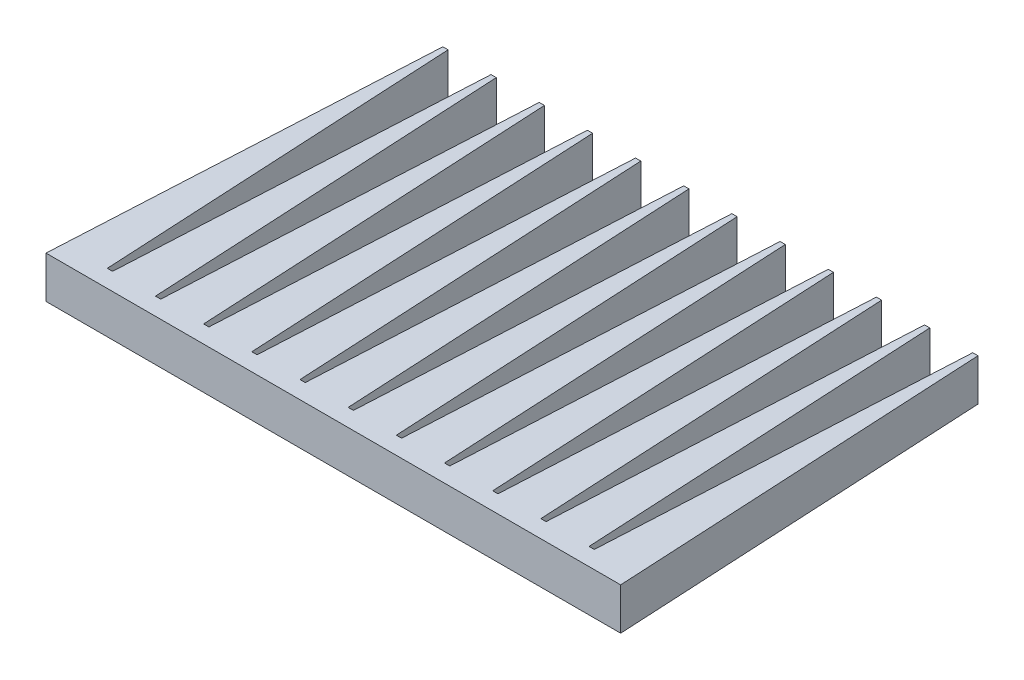
from build123d import *

# Parameters (mm, degrees)
BOSS_EXTRUDE1_DEPTH = 12


with BuildPart() as part:
    # Sketch1 → Boss-Extrude1 (new body)
    with BuildSketch(Plane(origin=(0, 0, 0), x_dir=(1, 0, 0), z_dir=(0, 1, 0))):
        Polygon((0.05286405, -1.233322687), (58.079634763, -1.233322687), (58.340079822, -1.233322687), (58.078040925, 3.766677313), (52.680039659, 106.766677313), (51.180039659, 106.766677313), (45.782038393, 3.766677313), (44.282038393, 3.766677313), (38.884037127, 106.766677313), (37.384037127, 106.766677313), (31.98603586, 3.766677313), (30.48603586, 3.766677313), (25.088034594, 106.766677313), (23.588034594, 106.766677313), (18.190033328, 3.766677313), (16.690033328, 3.766677313), (11.292032062, 106.766677313), (9.792032062, 106.766677313), (4.394030796, 3.766677313), (2.894030796, 3.766677313), (-2.50397047, 106.766677313), (-4.00397047, 106.766677313), (-9.401971736, 3.766677313), (-10.901971736, 3.766677313), (-16.299973003, 106.766677313), (-17.799973003, 106.766677313), (-23.197974269, 3.766677313), (-24.697974269, 3.766677313), (-30.095975535, 106.766677313), (-31.595975535, 106.766677313), (-36.993976801, 3.766677313), (-38.493976801, 3.766677313), (-43.891978067, 106.766677313), (-45.391978067, 106.766677313), (-50.789979333, 3.766677313), (-52.289979333, 3.766677313), (-57.6879806, 106.766677313), (-59.1879806, 106.766677313), (-64.585981866, 3.766677313), (-66.085981866, 3.766677313), (-71.483983132, 106.766677313), (-72.983983132, 106.766677313), (-78.381984398, 3.766677313), (-79.881984398, 3.766677313), (-85.279985664, 106.766677313), (-86.779985664, 106.766677313), (-92.17798693, 3.766677313), (-93.67798693, 3.766677313), (-99.075988196, 106.766677313), (-100.575988196, 106.766677313), (-105.973989463, 3.766677313), (-106.236028359, -1.233322687), align=None)
    extrude(amount=BOSS_EXTRUDE1_DEPTH)


solid = part.part
